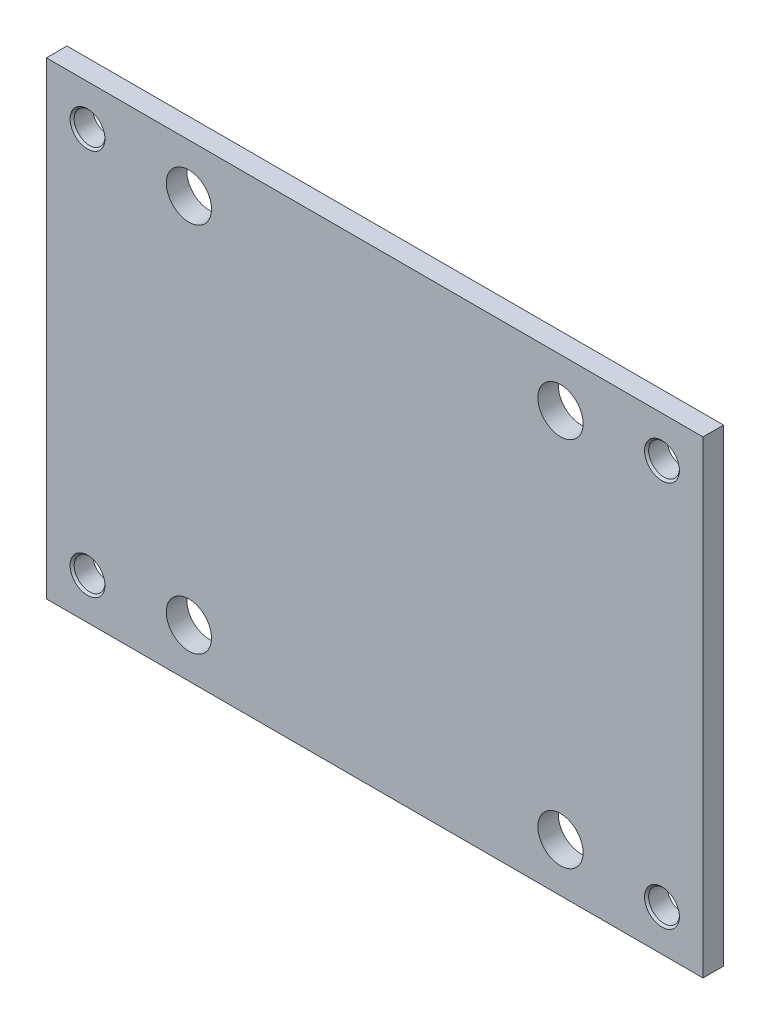
from build123d import *

# Parameters (mm, degrees)
SKETCH1_W                              = 203.2
SKETCH1_H                              = 145.034
BOSS_EXTRUDE1_DEPTH                    = 6.35
F_3_8_0_375_DIAMETER_HOLE1_D           = 9.525
F_3_8_0_375_DIAMETER_HOLE1_CSINK_D     = 10.795
F_3_8_0_375_DIAMETER_HOLE1_CSINK_ANGLE = 90
SKETCH4_R                              = 7
CUT_EXTRUDE1_DEPTH                     = 125.986390415


with BuildPart() as part:
    # Sketch1 → Boss-Extrude1 (new body)
    with BuildSketch(Plane.XY):
        Rectangle(SKETCH1_W, SKETCH1_H)
    extrude(amount=BOSS_EXTRUDE1_DEPTH)

    # 3/8 (0.375) Diameter Hole1 (through all)
    with Locations(Plane.XY.offset(6.35)):
        with Locations((-88.9, 59.817), (-88.9, -59.817), (88.9, -59.817), (88.9, 59.817)):
            CounterSinkHole(F_3_8_0_375_DIAMETER_HOLE1_D / 2, F_3_8_0_375_DIAMETER_HOLE1_CSINK_D / 2, counter_sink_angle=F_3_8_0_375_DIAMETER_HOLE1_CSINK_ANGLE)

    # Sketch4 → Cut-Extrude1 (cut, through all)
    with BuildSketch(Plane(origin=(0, 0, 0), x_dir=(-1, 0, 0), z_dir=(0, 0, -1))):
        with Locations((-57.483, 57.517)):
            Circle(SKETCH4_R)
        with Locations((57.517, 57.517)):
            Circle(SKETCH4_R)
        with Locations((57.517, -57.483)):
            Circle(SKETCH4_R)
        with Locations((-57.483, -57.483)):
            Circle(SKETCH4_R)
    extrude(amount=-CUT_EXTRUDE1_DEPTH, mode=Mode.SUBTRACT)


solid = part.part
